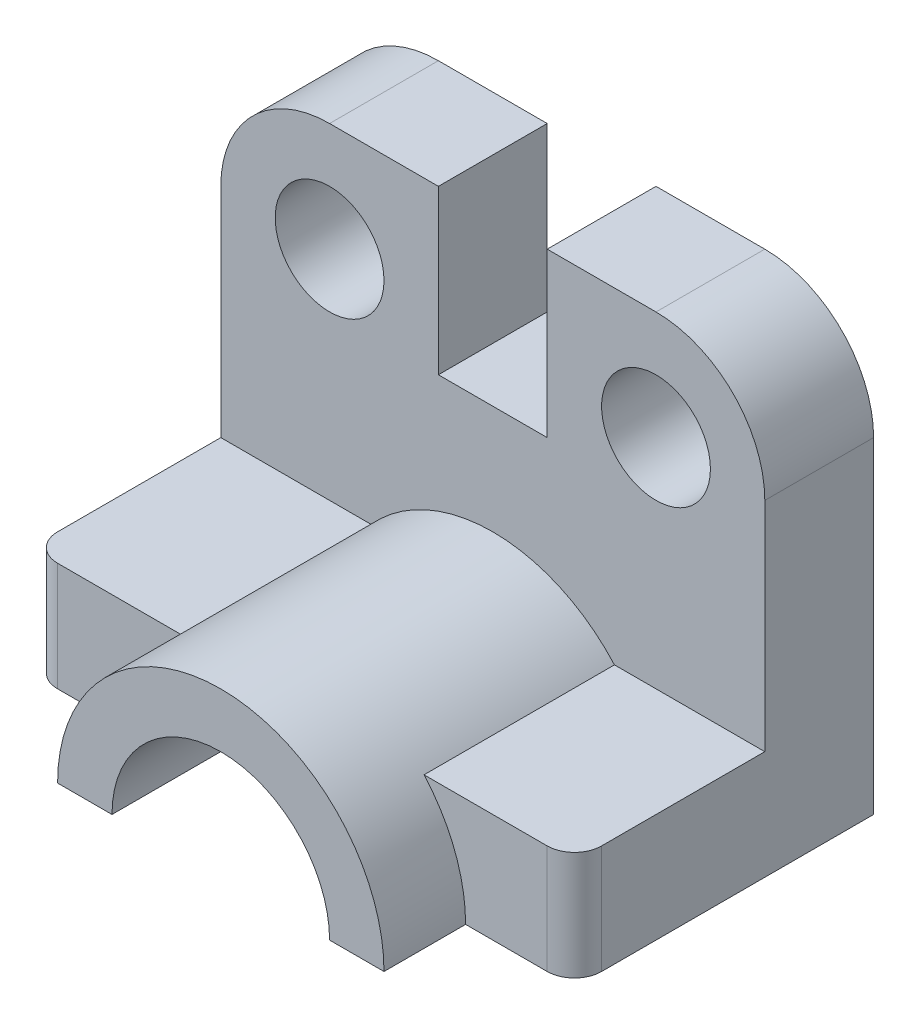
from build123d import *

# Parameters (mm, degrees)
SKETCH_1_R          = 10
EXTRUDE_1_DEPTH     = 20
FILLET_1_R          = 20
EXTRUDE_2_DEPTH     = 50
SKETCH_3_W          = 100
SKETCH_3_H          = 20
EXTRUDE_3_DEPTH     = 35
FILLET_2_R          = 5
CUT_EXTRUDE_START   = -50
CUT_EXTRUDE_1_DEPTH = 50


with BuildPart() as part:
    # 草圖1 → 填料-伸長1 (new body)
    with BuildSketch(Plane.XY):
        Polygon((-50, 80), (-10, 80), (-10, 50), (10, 50), (10, 80), (50, 80), (50, 0), (-50, 0), align=None)
        with Locations((-30, 60)):
            Circle(SKETCH_1_R, mode=Mode.SUBTRACT)
        with Locations((30, 60)):
            Circle(SKETCH_1_R, mode=Mode.SUBTRACT)
    extrude(amount=EXTRUDE_1_DEPTH)

    # 圓角1
    fillet_1_edges = [part.edges().sort_by_distance(p)[0] for p in [
        (-50, 80, 10),
        (50, 80, 10),
    ]]
    fillet(fillet_1_edges, radius=FILLET_1_R)

    # 草圖2 → 填料-伸長2 (add)
    with BuildSketch(Plane.XY.offset(20)):
        with BuildLine():
            ThreePointArc((-20, 0), (0, 20), (20, 0))
            Line((20, 0), (30, 0))
            ThreePointArc((30, 0), (0, 30), (-30, 0))
            Line((-30, 0), (-20, 0))
        make_face()
    extrude(amount=EXTRUDE_2_DEPTH)

    # 草圖3 → 填料-伸長3 (add)
    with BuildSketch(Plane.XY.offset(20)):
        with Locations((0, 10)):
            Rectangle(SKETCH_3_W, SKETCH_3_H)
    extrude(amount=EXTRUDE_3_DEPTH)

    # 圓角2
    fillet_2_edges = [part.edges().sort_by_distance(p)[0] for p in [
        (50, 10, 55),
        (-50, 10, 55),
    ]]
    fillet(fillet_2_edges, radius=FILLET_2_R)

    # 草圖4 → 除料-伸長1 (cut)
    with BuildSketch(Plane.XY.offset(70).offset(CUT_EXTRUDE_START)):
        with BuildLine():
            Line((-20, 0), (20, 0))
            ThreePointArc((20, 0), (0, 20), (-20, 0))
        make_face()
    extrude(amount=CUT_EXTRUDE_1_DEPTH, mode=Mode.SUBTRACT)


solid = part.part
